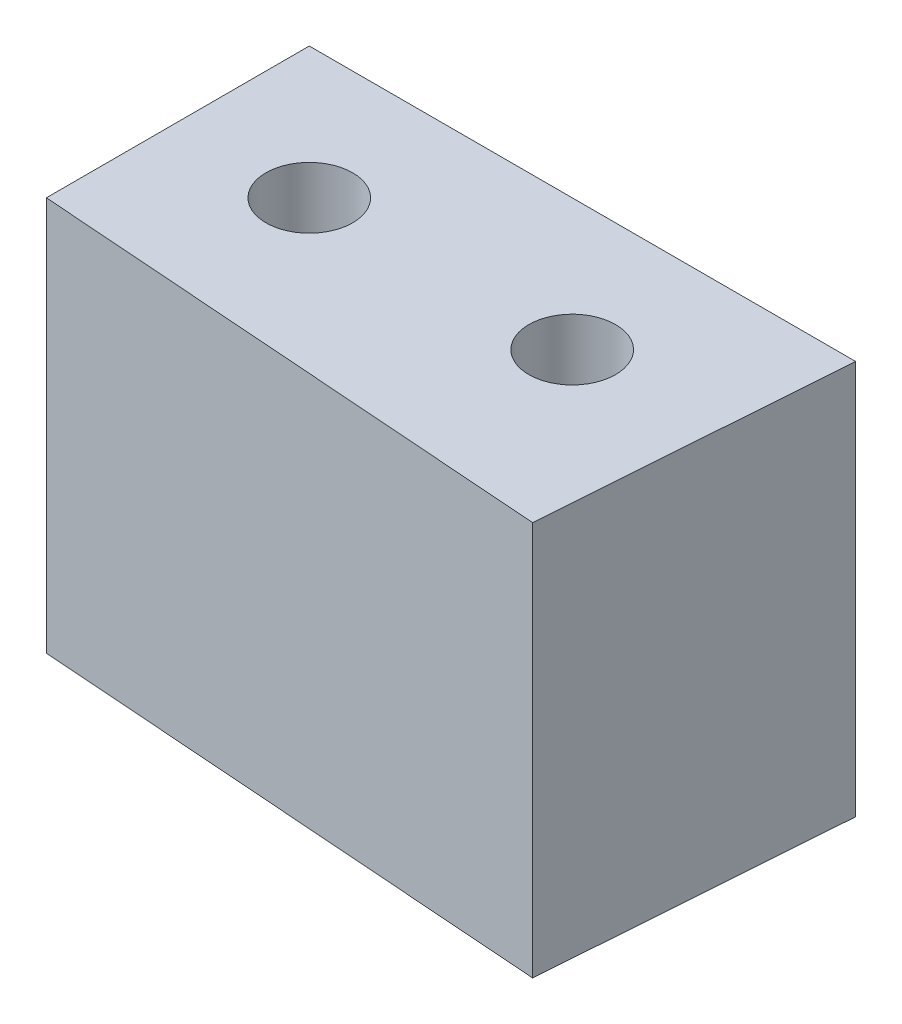
from build123d import *

# Parameters (mm, degrees)
EXTRUDE_1_DEPTH     = 15
SKETCH_2_R          = 1.45
CUT_EXTRUDE_1_DEPTH = 29.071464012
SKETCH_3_R          = 1.65
CUT_EXTRUDE_2_DEPTH = 29.071464012


with BuildPart() as part:
    # 草图1 → 凸台-拉伸1 (new body)
    with BuildSketch(Plane(origin=(0, 0, 0), x_dir=(1, 0, 0), z_dir=(0, 1, 0))):
        Polygon((0, 0), (0, -10), (19.947198592, -11.452332033), (20.781029397, 0), align=None)
    extrude(amount=EXTRUDE_1_DEPTH)

    # 草图2 → 切除-拉伸1 (cut, through all)
    with BuildSketch(Plane.XZ):
        with Locations(Location((5, 5, 0), (0, 0, 270))):
            Circle(SKETCH_2_R)
        with Locations(Location((15, 5, 0), (0, 0, 270))):
            Circle(SKETCH_2_R)
    extrude(amount=-CUT_EXTRUDE_1_DEPTH, mode=Mode.SUBTRACT)

    # 草图3 → 切除-拉伸2 (cut, through all)
    with BuildSketch(Plane.XZ):
        with Locations(Location((5, 5, 0), (0, 0, 270))):
            Circle(SKETCH_3_R)
        with Locations(Location((15, 5, 0), (0, 0, 270))):
            Circle(SKETCH_3_R)
    extrude(amount=-CUT_EXTRUDE_2_DEPTH, mode=Mode.SUBTRACT)


solid = part.part
